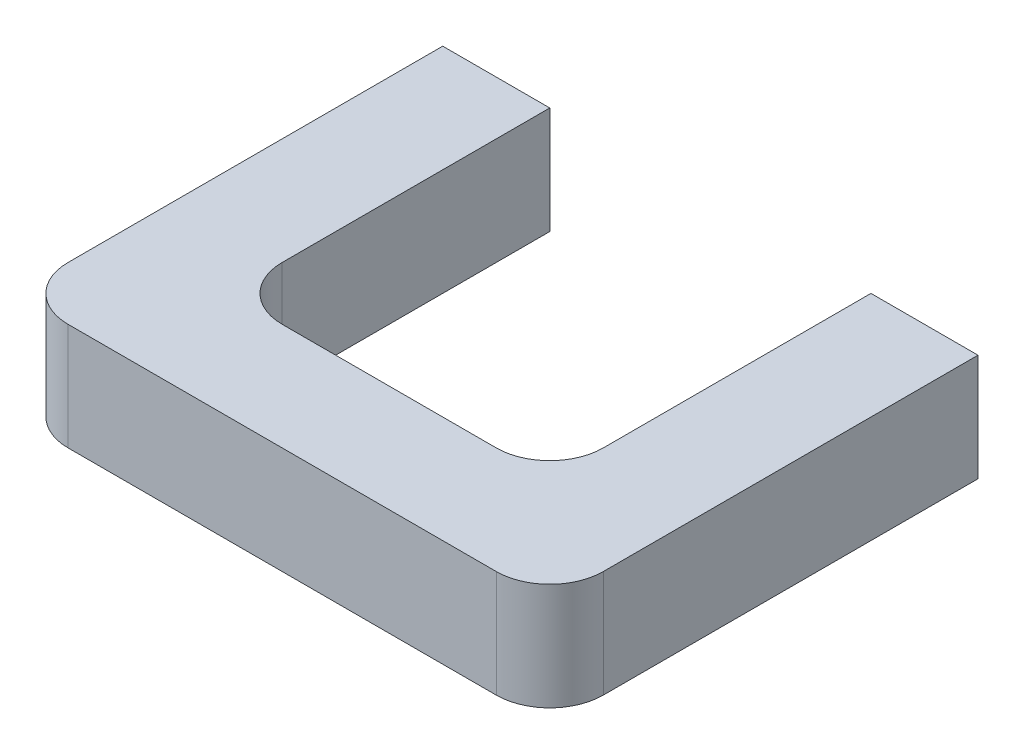
from build123d import *

# Parameters (mm, degrees)
BOSS_EXTRUDE1_DEPTH = 25.4
FILLET1_R           = 12.7
FILLET2_R           = 12.7
FILLET3_R           = 12.7
FILLET4_R           = 12.7


with BuildPart() as part:
    # Sketch1 → Boss-Extrude1 (new body)
    with BuildSketch(Plane(origin=(0, 0, 0), x_dir=(1, 0, 0), z_dir=(0, 1, 0))):
        Polygon((-18.361102201, 138.158284392), (-18.361102201, 36.558284392), (108.638897799, 36.558284392), (108.638897799, 138.158284392), (83.238897799, 138.158284392), (83.238897799, 61.958284392), (7.038897799, 61.958284392), (7.038897799, 138.158284392), align=None)
    extrude(amount=BOSS_EXTRUDE1_DEPTH)

    # Fillet1
    fillet1_edges = [part.edges().sort_by_distance(p)[0] for p in [
        (83.238897799, 12.7, -61.958284392),
    ]]
    fillet(fillet1_edges, radius=FILLET1_R)

    # Fillet2
    fillet2_edges = [part.edges().sort_by_distance(p)[0] for p in [
        (7.038897799, 12.7, -61.958284392),
    ]]
    fillet(fillet2_edges, radius=FILLET2_R)

    # Fillet3
    fillet3_edges = [part.edges().sort_by_distance(p)[0] for p in [
        (108.638897799, 12.7, -36.558284392),
    ]]
    fillet(fillet3_edges, radius=FILLET3_R)

    # Fillet4
    fillet4_edges = [part.edges().sort_by_distance(p)[0] for p in [
        (-18.361102201, 12.7, -36.558284392),
    ]]
    fillet(fillet4_edges, radius=FILLET4_R)


solid = part.part
